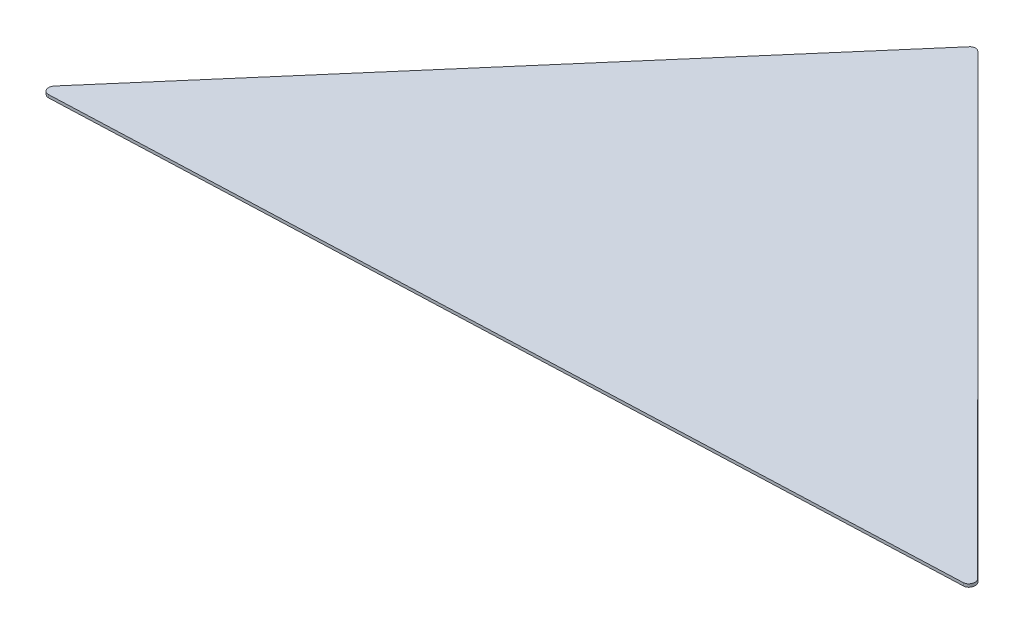
from build123d import *

# Parameters (mm, degrees)
BOSS_EXTRUDE1_DEPTH = 2


with BuildPart() as part:
    # Sketch2 → Boss-Extrude1 (new body)
    with BuildSketch(Plane(origin=(75.209264803, -1945.500458031, -70.562482719), x_dir=(0.9992543484228519, 0.038603856587709914, 0.0006995817159617483), z_dir=(-0.03860385658770992, 0.998597990155389, 0.03621872877633121))):
        with BuildLine():
            Line((121.661795946, 916.744830805), (-185.977682848, 609.510517299))
            ThreePointArc((-185.977682848, 609.510517299), (-186.847142363, 605.15071094), (-183.151120103, 602.680227023))
            Line((-183.151120103, 602.680227023), (431.722672198, 602.680227023))
            ThreePointArc((431.722672198, 602.680227023), (435.418190328, 605.149493294), (434.551099323, 609.508654148))
            Line((434.551099323, 609.508654148), (127.316785816, 916.742967654))
            ThreePointArc((127.316785816, 916.742967654), (124.489676573, 917.914540312), (121.661795946, 916.744830805))
        make_face()
    extrude(amount=BOSS_EXTRUDE1_DEPTH)


solid = part.part
